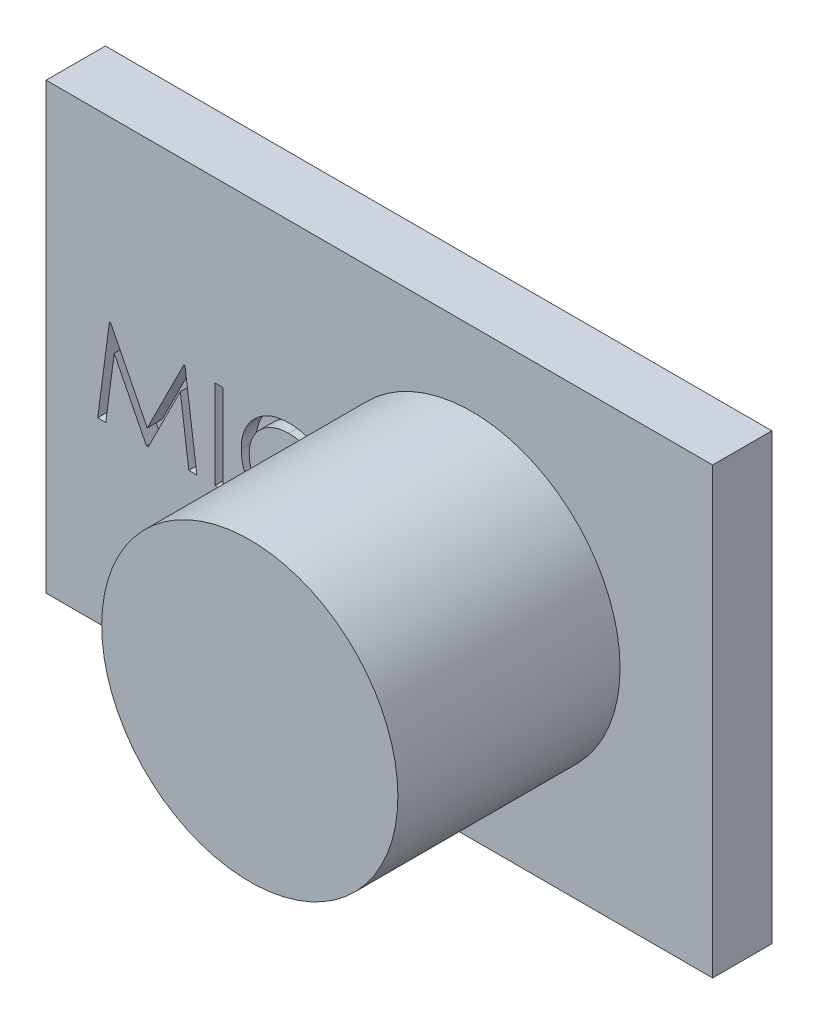
from build123d import *

# Parameters (mm, degrees)
SKETCH1_W           = 22.5
SKETCH1_H           = 15
BOSS_EXTRUDE1_DEPTH = 2
SKETCH2_R           = 5
BOSS_EXTRUDE2_DEPTH = 7.5
SKETCH3_W           = 0.269230769
SKETCH3_H           = 3
CUT_EXTRUDE1_DEPTH  = 0.5


with BuildPart() as part:
    # Sketch1 → Boss-Extrude1 (new body)
    with BuildSketch(Plane.XY):
        Rectangle(SKETCH1_W, SKETCH1_H)
    extrude(amount=BOSS_EXTRUDE1_DEPTH)

    # Sketch2 → Boss-Extrude2 (add)
    with BuildSketch(Plane.XY.offset(2)):
        with Locations((3.125, 0)):
            Circle(SKETCH2_R)
    extrude(amount=BOSS_EXTRUDE2_DEPTH)

    # Sketch3 → Cut-Extrude1 (cut)
    with BuildSketch(Plane.XY.offset(2)):
        Polygon((-9.509615385, -1.5), (-9.113581731, 1.5), (-9.075120192, 1.5), (-7.836538462, -0.961538462), (-6.6015625, 1.5), (-6.563100962, 1.5), (-6.163461538, -1.5), (-6.432692308, -1.5), (-6.721153846, 0.656850962), (-7.803485577, -1.5), (-7.864783654, -1.5), (-8.951923077, 0.663461538), (-9.238581731, -1.5), align=None)
        with Locations((-5.413461539, 0)):
            Rectangle(SKETCH3_W, SKETCH3_H)
        with BuildLine():
            Line((-1.740384615, 0.949519231), (-1.975961538, 0.769230769))
            add(Edge.make_bspline(
                [(-1.975961538, 0.769230769), (-1.992766586, 0.789258743), (-2.026150111, 0.829044671), (-2.079857999, 0.884912852), (-2.135830836, 0.937254505), (-2.194047226, 0.986318973), (-2.255555042, 1.030390487), (-2.318864298, 1.071765718), (-2.385034051, 1.10885235), (-2.476535538, 1.153820624), (-2.596233694, 1.2007459), (-2.746914985, 1.240091526), (-2.904210212, 1.265138248), (-3.01152244, 1.26785097), (-3.066105769, 1.269230769)],
                knots=[0, 0, 0, 0, 0.757959112, 1.505699292, 2.245454638, 2.979532153, 3.711538275, 4.438200793, 5.171680507, 5.909471876, 7.393775596, 8.890124382, 10.418191784, 12, 12, 12, 12], degree=3))
            add(Edge.make_bspline(
                [(-3.066105769, 1.269230769), (-3.096177169, 1.268884516), (-3.156040877, 1.268195222), (-3.244882425, 1.259101686), (-3.332065041, 1.246320649), (-3.417532012, 1.227356086), (-3.501174547, 1.203379556), (-3.583539464, 1.174729201), (-3.663434263, 1.139282195), (-3.741964182, 1.100103687), (-3.817203506, 1.055851591), (-3.888393547, 1.007583004), (-3.955274662, 0.955838064), (-4.017899758, 0.90042283), (-4.076332857, 0.841586864), (-4.130150552, 0.778703143), (-4.179166617, 0.711972708), (-4.224352639, 0.642275502), (-4.264820696, 0.569814537), (-4.29870345, 0.49432162), (-4.32870784, 0.417089531), (-4.352450048, 0.337245679), (-4.371242491, 0.25535188), (-4.38420906, 0.171188348), (-4.393199178, 0.084930908), (-4.393885044, 0.026465783), (-4.394230769, -0.003004808)],
                knots=[0, 0, 0, 0, 1.054917814, 2.100044995, 3.131103042, 4.146048494, 5.169673617, 6.183595914, 7.203665975, 8.234915748, 9.262203917, 10.264457458, 11.251630812, 12.227803204, 13.197192746, 14.159520551, 15.12972552, 16.100847026, 17.073214652, 18.039054194, 19.002613845, 19.979014051, 20.95965708, 21.949030935, 22.966165397, 24, 24, 24, 24], degree=3))
            add(Edge.make_bspline(
                [(-4.394230769, -0.003004808), (-4.39314921, -0.047345939), (-4.391025712, -0.134403869), (-4.37212714, -0.261921535), (-4.34340849, -0.384082113), (-4.300366567, -0.500121977), (-4.247293095, -0.611471999), (-4.180229714, -0.716248159), (-4.102558396, -0.816033785), (-4.013180323, -0.908470598), (-3.915118195, -0.992910934), (-3.809905699, -1.067268575), (-3.697804881, -1.12925276), (-3.580053483, -1.180832143), (-3.455745386, -1.220480766), (-3.325104127, -1.248392872), (-3.188413845, -1.266600456), (-3.095011502, -1.268343617), (-3.047475962, -1.269230769)],
                knots=[0, 0, 0, 0, 1.029171465, 2.020641659, 2.987623507, 3.938342917, 4.889210282, 5.84687017, 6.821220943, 7.821438502, 8.827599549, 9.822697543, 10.807740252, 11.797342354, 12.80366471, 13.83203677, 14.896651826, 16, 16, 16, 16], degree=3))
            add(Edge.make_bspline(
                [(-3.047475962, -1.269230769), (-2.995102228, -1.267783244), (-2.892018192, -1.264934167), (-2.740845598, -1.240797668), (-2.596129227, -1.20166231), (-2.457861296, -1.146892662), (-2.326431599, -1.075693844), (-2.201634462, -0.989381378), (-2.083364544, -0.887134235), (-2.012246302, -0.809062982), (-1.975961538, -0.769230769)],
                knots=[0, 0, 0, 0, 1.028121516, 2.023589091, 2.998037872, 3.967518031, 4.937445131, 5.927275754, 6.942489185, 8, 8, 8, 8], degree=3))
            Line((-1.975961538, -0.769230769), (-1.740384615, -0.947716346))
            add(Edge.make_bspline(
                [(-1.740384615, -0.947716346), (-1.759342995, -0.972177876), (-1.797168946, -1.020983767), (-1.858418674, -1.08978809), (-1.922942072, -1.154505835), (-1.991218395, -1.214615224), (-2.062462216, -1.271319052), (-2.13795277, -1.323006336), (-2.216697655, -1.370398523), (-2.298430065, -1.413793029), (-2.383063162, -1.452293527), (-2.470495535, -1.485253899), (-2.560350314, -1.513646662), (-2.652631607, -1.537005464), (-2.747530827, -1.555237822), (-2.844705519, -1.567426115), (-2.944365412, -1.575776327), (-3.011600916, -1.576537398), (-3.045673077, -1.576923077)],
                knots=[0, 0, 0, 0, 0.986787822, 1.968848986, 2.935600012, 3.899624008, 4.868462664, 5.837806735, 6.815139263, 7.798259679, 8.787526145, 9.778297419, 10.776456485, 11.791383307, 12.812564526, 13.85620153, 14.913611965, 16, 16, 16, 16], degree=3))
            add(Edge.make_bspline(
                [(-3.045673077, -1.576923077), (-3.077939077, -1.576698512), (-3.141741097, -1.576254462), (-3.235940027, -1.569061176), (-3.327645382, -1.559247116), (-3.416595062, -1.544469861), (-3.503274469, -1.527031855), (-3.586897827, -1.503656492), (-3.668288007, -1.477471492), (-3.747118014, -1.446695789), (-3.823454899, -1.411967633), (-3.897052452, -1.372717725), (-3.967876822, -1.329276127), (-4.036624326, -1.282600404), (-4.102279398, -1.231191288), (-4.165410991, -1.175762744), (-4.226373113, -1.116501592), (-4.2640897, -1.07376886), (-4.283052885, -1.052283654)],
                knots=[0, 0, 0, 0, 1.114604814, 2.203992996, 3.262667896, 4.300477797, 5.318619304, 6.316056647, 7.298880507, 8.271930387, 9.238335007, 10.195173496, 11.151986948, 12.108099108, 13.064862484, 14.031167946, 15.010108607, 16, 16, 16, 16], degree=3))
            add(Edge.make_bspline(
                [(-4.283052885, -1.052283654), (-4.313426293, -1.014962635), (-4.373806416, -0.940771169), (-4.451057002, -0.820526042), (-4.517183478, -0.694981863), (-4.570648553, -0.563479067), (-4.612445181, -0.426312735), (-4.641400492, -0.283413723), (-4.660216153, -0.134915486), (-4.662367829, -0.033912525), (-4.663461538, 0.017427885)],
                knots=[0, 0, 0, 0, 0.994628077, 1.977248131, 2.950237994, 3.925870899, 4.908910175, 5.911660606, 6.938484602, 8, 8, 8, 8], degree=3))
            add(Edge.make_bspline(
                [(-4.663461538, 0.017427885), (-4.662128515, 0.071389702), (-4.659505876, 0.177556209), (-4.637223765, 0.333362454), (-4.601379083, 0.482635082), (-4.550467464, 0.625095434), (-4.48592002, 0.761492818), (-4.406182923, 0.890785279), (-4.312182515, 1.013799679), (-4.204656028, 1.128669465), (-4.08674117, 1.233703196), (-3.960467901, 1.326108514), (-3.826083375, 1.403009242), (-3.685068073, 1.467291667), (-3.53636606, 1.516701206), (-3.380294601, 1.551289652), (-3.21714696, 1.572818609), (-3.105836309, 1.575540216), (-3.049278846, 1.576923077)],
                knots=[0, 0, 0, 0, 1.032925535, 2.032216505, 3.007276963, 3.968222605, 4.92396291, 5.891752235, 6.871517503, 7.883894988, 8.900124299, 9.891468569, 10.874487609, 11.85992873, 12.854644235, 13.869047385, 14.917252991, 16, 16, 16, 16], degree=3))
            add(Edge.make_bspline(
                [(-3.049278846, 1.576923077), (-3.014809299, 1.576509816), (-2.946580301, 1.575691806), (-2.845649456, 1.567715113), (-2.747384604, 1.554417736), (-2.651718048, 1.536318248), (-2.558184377, 1.51385483), (-2.467498457, 1.484591717), (-2.379128154, 1.451131833), (-2.293630804, 1.412596005), (-2.211416618, 1.369338798), (-2.132511202, 1.321839692), (-2.057541323, 1.270157573), (-1.985979453, 1.214731994), (-1.919022701, 1.154390372), (-1.854770005, 1.090792432), (-1.795403366, 1.022106297), (-1.758757771, 0.973759211), (-1.740384615, 0.949519231)],
                knots=[0, 0, 0, 0, 1.096760587, 2.17092713, 3.219439832, 4.250915756, 5.268269357, 6.278326846, 7.281116186, 8.274029601, 9.260640565, 10.235837813, 11.203064059, 12.156899882, 13.114053108, 14.069676657, 15.032185724, 16, 16, 16, 16], degree=3))
        make_face()
    extrude(amount=-CUT_EXTRUDE1_DEPTH, mode=Mode.SUBTRACT)


solid = part.part
